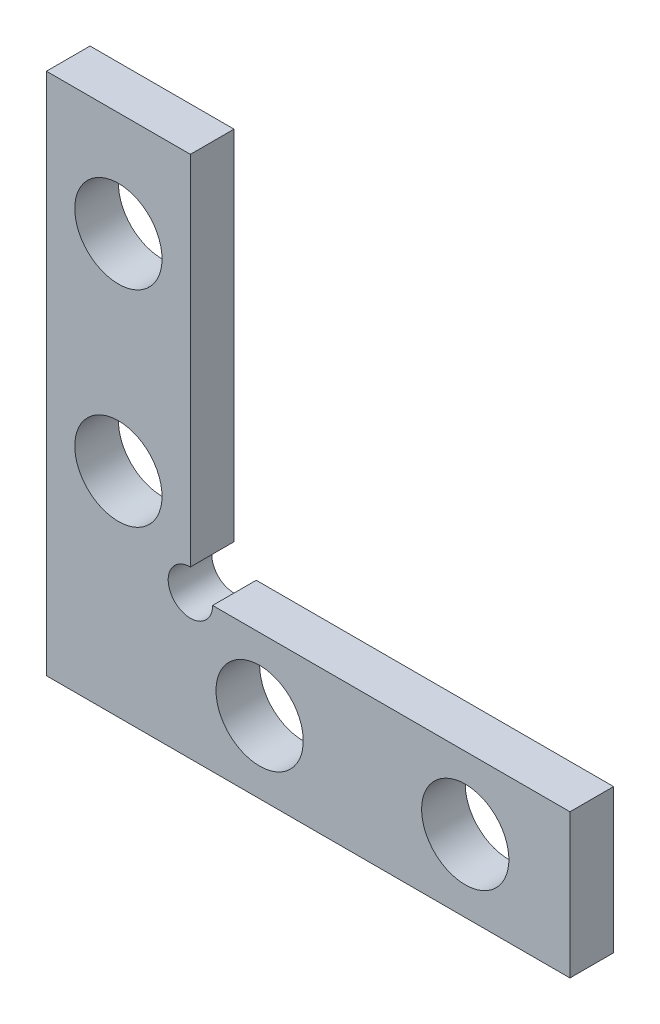
from build123d import *

# Parameters (mm, degrees)
SKETCH_1_W          = 9.9
SKETCH_1_H          = 36
EXTRUDE_1_DEPTH     = 3
SKETCH_2_W          = 36
SKETCH_2_H          = 9.9
EXTRUDE_2_DEPTH     = 3
SKETCH_3_R          = 3
CUT_EXTRUDE_1_DEPTH = 52
SKETCH_4_R          = 1.527094442
CUT_EXTRUDE_2_DEPTH = 52


with BuildPart() as part:
    # 草图1 → 凸台-拉伸1 (new body)
    with BuildSketch(Plane.XY):
        with Locations((4.95, 18)):
            Rectangle(SKETCH_1_W, SKETCH_1_H)
    extrude(amount=EXTRUDE_1_DEPTH)

    # 草图2 → 凸台-拉伸2 (add)
    with BuildSketch(Plane.XY.offset(3)):
        with Locations((18, 4.95)):
            Rectangle(SKETCH_2_W, SKETCH_2_H)
    extrude(amount=-EXTRUDE_2_DEPTH)

    # 草图3 → 切除-拉伸1 (cut, through all)
    with BuildSketch(Plane.XY.offset(3)):
        with Locations((4.95, 28.797804346)):
            Circle(SKETCH_3_R)
        with Locations((4.95, 14.661403113)):
            Circle(SKETCH_3_R)
        with Locations(Location((14.661403113, 4.95, 0), (0, 0, 180))):
            Circle(SKETCH_3_R)
        with Locations(Location((28.797804346, 4.95, 0), (0, 0, 180))):
            Circle(SKETCH_3_R)
    extrude(amount=-CUT_EXTRUDE_1_DEPTH, mode=Mode.SUBTRACT)

    # 草图4 → 切除-拉伸2 (cut, through all)
    with BuildSketch(Plane.XY.offset(3)):
        with Locations((9.9, 9.9)):
            Circle(SKETCH_4_R)
    extrude(amount=-CUT_EXTRUDE_2_DEPTH, mode=Mode.SUBTRACT)


solid = part.part
